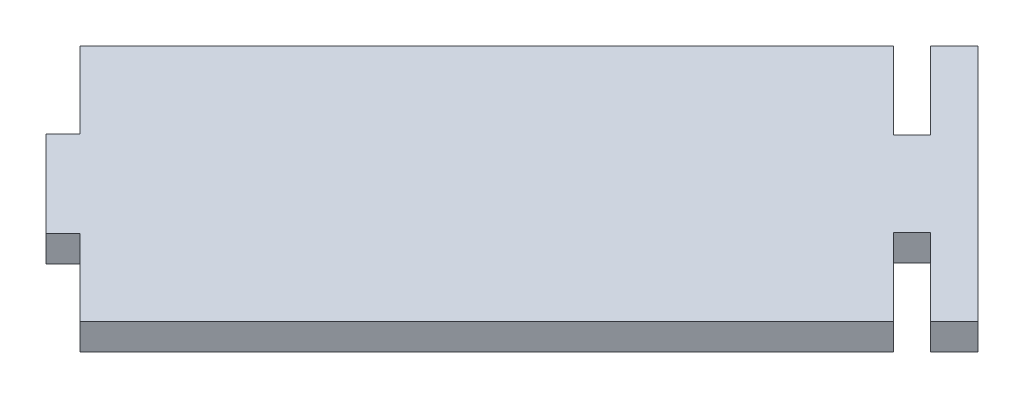
from build123d import *

# Parameters (mm, degrees)
BOSS_EXTRUDE1_DEPTH = 2.2


with BuildPart() as part:
    # Sketch1 → Boss-Extrude1 (new body)
    with BuildSketch(Plane(origin=(0, 0, 0), x_dir=(1, 0, 0), z_dir=(0, 1, 0))):
        Polygon((67.00974798, 38.039967247), (65.029848993, 36.06006826), (71.445707182, 29.64421007), (69.890072263, 28.088575152), (63.474214074, 34.504433341), (34.506193271, 5.536412538), (29.533088577, 0.563307844), (35.897049608, -5.800653187), (34.482836045, -7.214866749), (41.657698175, -14.389728878), (43.071911737, -12.975515316), (49.435872768, -19.339476346), (54.408977462, -14.366371652), (83.376998265, 14.60164915), (76.961140075, 21.01750734), (78.516774994, 22.573142258), (84.932633183, 16.157284069), (86.912532171, 18.137183056), align=None)
    extrude(amount=BOSS_EXTRUDE1_DEPTH)


solid = part.part
